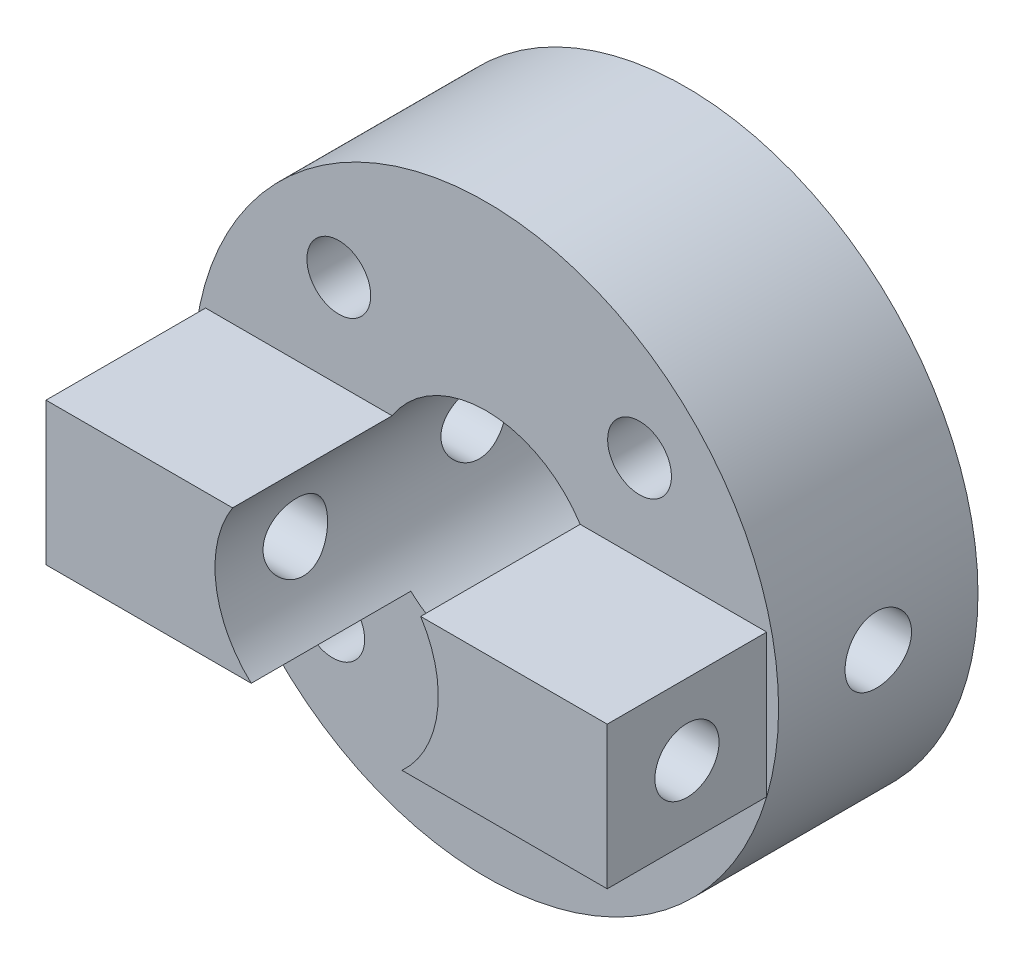
from build123d import *

# Parameters (mm, degrees)
SKETCH1_R               = 11
SKETCH1_R_2             = 4.2
BOSS_EXTRUDE1_DEPTH     = 7.5
CUT_EXTRUDE1_DEPTH      = 18.956588045
CUT_EXTRUDE1_DEPTH_BACK = 18.956588045
SKETCH2_R               = 1.25
SKETCH1_4_R             = 1.2
CUT_EXTRUDE3_DEPTH      = 18.956588216
CIRPATTERN2_COUNT       = 4
SKETCH3_W               = 21.108856579
SKETCH3_H               = 5.364192866
BOSS_EXTRUDE2_DEPTH     = 6
SKETCH4_R               = 1.20682121
CUT_EXTRUDE4_DEPTH      = 28.878127015
SKETCH1_5_R             = 4.2
CUT_EXTRUDE5_DEPTH      = 22.176379739


with BuildPart() as part:
    # Sketch1 → Boss-Extrude1 (new body)
    with BuildSketch(Plane.XY):
        with Locations((-0.655147954, 0.416942691)):
            Circle(SKETCH1_R)
        with Locations((-0.655147954, 0.416942691)):
            Circle(SKETCH1_R_2, mode=Mode.SUBTRACT)
    extrude(amount=BOSS_EXTRUDE1_DEPTH)

    # Sketch2 → Cut-Extrude1 (cut, two sides: drawn at the far end of the back side and taken through both)
    with BuildSketch(Plane(origin=(0, 0, 0), x_dir=(0, 0, -1), z_dir=(1, 0, 0)).offset(-CUT_EXTRUDE1_DEPTH_BACK)):
        with Locations((-3.75, 0.416942691)):
            Circle(SKETCH2_R)
    extrude(amount=CUT_EXTRUDE1_DEPTH + CUT_EXTRUDE1_DEPTH_BACK, mode=Mode.SUBTRACT)

    # Sketch1<4> → Cut-Extrude3 (cut, through all)
    with BuildSketch(Plane.XY):
        with Locations((-6.42500216, -5.124607853)):
            Circle(SKETCH1_4_R)
    cut_extrude3 = extrude(amount=CUT_EXTRUDE3_DEPTH, mode=Mode.SUBTRACT)

    # CirPattern2: Cut-Extrude3 ×4 about axis
    cirpattern2_axis = Axis((-0.655147954, 0.416942691, 7.5), (0, 0, 1))
    for i in range(1, CIRPATTERN2_COUNT):
        add(cut_extrude3.rotate(cirpattern2_axis, i * 360 / CIRPATTERN2_COUNT), mode=Mode.SUBTRACT)

    # Sketch3 → Boss-Extrude2 (add)
    with BuildSketch(Plane.XY.offset(7.5)):
        with Locations((-0.655147954, 0)):
            Rectangle(SKETCH3_W, SKETCH3_H)
    extrude(amount=BOSS_EXTRUDE2_DEPTH)

    # Sketch4 → Cut-Extrude4 (cut, through all)
    with BuildSketch(Plane.ZY.offset(11.209576243)):
        with Locations((10.5, 0)):
            Circle(SKETCH4_R)
    extrude(amount=-CUT_EXTRUDE4_DEPTH, mode=Mode.SUBTRACT)

    # Sketch1<5> → Cut-Extrude5 (cut, through all)
    with BuildSketch(Plane.XY):
        with Locations((-0.655147954, 0.416942691)):
            Circle(SKETCH1_5_R)
    extrude(amount=CUT_EXTRUDE5_DEPTH, mode=Mode.SUBTRACT)


solid = part.part
